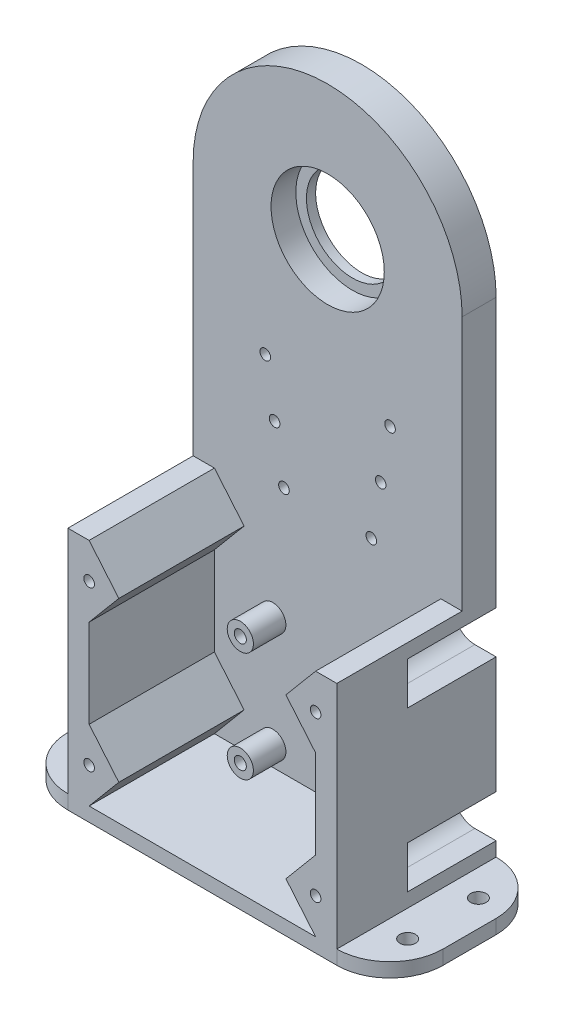
from build123d import *

# Parameters (mm, degrees)
SKIZZE1_W                       = 45
SKIZZE1_H                       = 65
AUFSATZ_LINEAR_AUSTRAGEN1_DEPTH = 38
SKIZZE2_OUTSIDE_W               = 99.932
SKIZZE2_OUTSIDE_H               = 88.932
SCHNITT_LINEAR_AUSTRAGEN1_DEPTH = 35.4
SCHNITT_LINEAR_AUSTRAGEN2_DEPTH = 25
SKIZZE4_R                       = 1.5
SCHNITT_LINEAR_AUSTRAGEN3_DEPTH = 80.334733881
AUFSATZ_LINEAR_AUSTRAGEN2_DEPTH = 9.6
SKIZZE6_R                       = 16
SCHNITT_LINEAR_AUSTRAGEN4_DEPTH = 7
SKIZZE8_R                       = 13
SCHNITT_LINEAR_AUSTRAGEN5_DEPTH = 185.645606501
SKIZZE9_R                       = 1.5
SCHNITT_LINEAR_AUSTRAGEN6_DEPTH = 185.645606501
SKIZZE12_W                      = 76
SKIZZE12_H                      = 45
AUFSATZ_LINEAR_AUSTRAGEN4_DEPTH = 4
SKIZZE10_W                      = 45
SKIZZE10_H                      = 4
AUFSATZ_LINEAR_AUSTRAGEN3_DEPTH = 15
VERRUNDUNG1_R                   = 15
SKIZZE11_R                      = 2.2
SCHNITT_LINEAR_AUSTRAGEN7_DEPTH = 181.433505758
VERRUNDUNG1_OF_SPIEGELN1_R      = 15
SKIZZE13_R                      = 3.7
SKIZZE13_R_2                    = 1.7
AUFSATZ_LINEAR_AUSTRAGEN5_DEPTH = 9.178687268
SCHNITT_LINEAR_START            = -9.6
SKIZZE14_R                      = 1.7
SCHNITT_LINEAR_AUSTRAGEN8_DEPTH = 9.6
SKIZZE15_R                      = 5
SCHNITT_LINEAR_AUSTRAGEN9_DEPTH = 9.6


with BuildPart() as part:
    # Skizze1 → Aufsatz-Linear austragen1 (new, symmetric)
    with BuildSketch(Plane(origin=(0, 0, 0), x_dir=(0, 0, -1), z_dir=(1, 0, 0))):
        with Locations((0, 32.5)):
            Rectangle(SKIZZE1_W, SKIZZE1_H)
    extrude(amount=AUFSATZ_LINEAR_AUSTRAGEN1_DEPTH, both=True)

    # Skizze2 outside → Schnitt-Linear austragen1 (cut)
    with BuildSketch(Plane.XY.offset(22.5)):
        with Locations((0, 32.5)):
            Rectangle(SKIZZE2_OUTSIDE_W, SKIZZE2_OUTSIDE_H)
        Polygon((-38, 0), (-32, 0), (-23.609003688, 10), (-32, 20), (-32, 45), (-23.609003688, 55), (-32, 65), (-38, 65), align=None, mode=Mode.SUBTRACT)
        Polygon((38, 65), (38, 0), (32, 0), (23.609003688, 10), (32, 20), (32, 45), (23.609003688, 55), (32, 65), align=None, mode=Mode.SUBTRACT)
    extrude(amount=-SCHNITT_LINEAR_AUSTRAGEN1_DEPTH, mode=Mode.SUBTRACT)

    # Skizze3 → Schnitt-Linear austragen2 (cut)
    with BuildSketch(Plane(origin=(0, 0, -22.5), x_dir=(-1, 0, 0), z_dir=(0, 0, -1))):
        with BuildLine():
            Line((-32, 16), (-38, 16))
            Line((-38, 16), (-38, 4))
            Line((-38, 4), (-32, 4))
            ThreePointArc((-32, 4), (-26, 10), (-32, 16))
        make_face()
        with BuildLine():
            Line((38, 16), (38, 4))
            Line((38, 4), (32, 4))
            ThreePointArc((32, 4), (26, 10), (32, 16))
            Line((32, 16), (38, 16))
        make_face()
        with BuildLine():
            Line((32, 49), (38, 49))
            Line((38, 49), (38, 61))
            Line((38, 61), (32, 61))
            ThreePointArc((32, 61), (26, 55), (32, 49))
        make_face()
        with BuildLine():
            Line((-38, 49), (-38, 61))
            Line((-38, 61), (-32, 61))
            ThreePointArc((-32, 61), (-26, 55), (-32, 49))
            Line((-32, 49), (-38, 49))
        make_face()
    extrude(amount=-SCHNITT_LINEAR_AUSTRAGEN2_DEPTH, mode=Mode.SUBTRACT)

    # Skizze4 → Schnitt-Linear austragen3 (cut, through all)
    with BuildSketch(Plane(origin=(0, 0, 2.5), x_dir=(-1, 0, 0), z_dir=(0, 0, -1))):
        with Locations(Location((32, 10, 0), (0, 0, 90))):
            Circle(SKIZZE4_R)
        with Locations(Location((-32, 10, 0), (0, 0, 270))):
            Circle(SKIZZE4_R)
        with Locations(Location((-32, 55, 0), (0, 0, 90))):
            Circle(SKIZZE4_R)
        with Locations(Location((32, 55, 0), (0, 0, 270))):
            Circle(SKIZZE4_R)
    extrude(amount=-SCHNITT_LINEAR_AUSTRAGEN3_DEPTH, mode=Mode.SUBTRACT)

    # Skizze5 → Aufsatz-Linear austragen2 (add)
    with BuildSketch(Plane.XY.offset(-12.9)):
        with BuildLine():
            Line((-38, 65), (38, 65))
            Line((38, 65), (38, 137))
            ThreePointArc((38, 137), (0, 175), (-38, 137))
            Line((-38, 137), (-38, 65))
        make_face()
    extrude(amount=-AUFSATZ_LINEAR_AUSTRAGEN2_DEPTH)

    # Skizze6 → Schnitt-Linear austragen4 (cut)
    with BuildSketch(Plane.XY.offset(-12.9)):
        with Locations((0, 137)):
            Circle(SKIZZE6_R)
    extrude(amount=-SCHNITT_LINEAR_AUSTRAGEN4_DEPTH, mode=Mode.SUBTRACT)

    # Skizze8 → Schnitt-Linear austragen5 (cut, through all)
    with BuildSketch(Plane(origin=(0, 0, -22.5), x_dir=(-1, 0, 0), z_dir=(0, 0, -1))):
        with Locations(Location((0, 137, 0), (0, 0, 90))):
            Circle(SKIZZE8_R)
    extrude(amount=-SCHNITT_LINEAR_AUSTRAGEN5_DEPTH, mode=Mode.SUBTRACT)

    # Skizze9 → Schnitt-Linear austragen6 (cut, through all)
    with BuildSketch(Plane(origin=(0, 0, -22.5), x_dir=(-1, 0, 0), z_dir=(0, 0, -1))):
        with Locations(Location((12.34288865, 70, 0), (0, 0, 90))):
            Circle(SKIZZE9_R)
        with Locations(Location((14.98779336, 85, 0), (0, 0, 90))):
            Circle(SKIZZE9_R)
        with Locations(Location((17.632698071, 100, 0), (0, 0, 90))):
            Circle(SKIZZE9_R)
        with Locations(Location((-12.34288865, 70, 0), (0, 0, 180))):
            Circle(SKIZZE9_R)
        with Locations(Location((-17.632698071, 100, 0), (0, 0, 180))):
            Circle(SKIZZE9_R)
        with Locations(Location((-14.98779336, 85, 0), (0, 0, 180))):
            Circle(SKIZZE9_R)
    extrude(amount=-SCHNITT_LINEAR_AUSTRAGEN6_DEPTH, mode=Mode.SUBTRACT)

    # Skizze12 → Aufsatz-Linear austragen4 (add)
    with BuildSketch(Plane.XZ):
        Rectangle(SKIZZE12_W, SKIZZE12_H)
    extrude(amount=AUFSATZ_LINEAR_AUSTRAGEN4_DEPTH)

    # Skizze10 → Aufsatz-Linear austragen3 (add)
    with BuildSketch(Plane(origin=(38, 0, 0), x_dir=(0, 0, -1), z_dir=(1, 0, 0))):
        with Locations((0, -2)):
            Rectangle(SKIZZE10_W, SKIZZE10_H)
    aufsatz_linear_austragen3 = extrude(amount=AUFSATZ_LINEAR_AUSTRAGEN3_DEPTH)

    # Verrundung1
    verrundung1_edges = [part.edges().sort_by_distance(p)[0] for p in [
        (53, -2, 22.5),
        (53, -2, -22.5),
    ]]
    fillet(verrundung1_edges, radius=VERRUNDUNG1_R)

    # Skizze11 → Schnitt-Linear austragen7 (cut, through all)
    with BuildSketch(Plane(origin=(0, 4, 0), x_dir=(1, 0, 0), z_dir=(0, 1, 0))):
        with Locations(Location((45.5, 10, 0), (0, 0, 180))):
            Circle(SKIZZE11_R)
        with Locations(Location((45.5, -10, 0), (0, 0, 90))):
            Circle(SKIZZE11_R)
    schnitt_linear_austragen7 = extrude(amount=-SCHNITT_LINEAR_AUSTRAGEN7_DEPTH, mode=Mode.SUBTRACT)

    # Spiegeln1: Aufsatz-Linear austragen3, Schnitt-Linear austragen7 across plane
    add(aufsatz_linear_austragen3.mirror(Plane(origin=(0, 0, 0), x_dir=(0, 0, 1), z_dir=(1, 0, 0))))
    add(schnitt_linear_austragen7.mirror(Plane(origin=(0, 0, 0), x_dir=(0, 0, 1), z_dir=(1, 0, 0))), mode=Mode.SUBTRACT)

    # Verrundung1 of Spiegeln1
    verrundung1_of_spiegeln1_edges = [part.edges().sort_by_distance(p)[0] for p in [
        (-53, -2, 22.5),
        (-53, -2, -22.5),
    ]]
    fillet(verrundung1_of_spiegeln1_edges, radius=VERRUNDUNG1_OF_SPIEGELN1_R)

    # Skizze13 → Aufsatz-Linear austragen5 (add)
    # profile 1 of 4: a face of its own
    with BuildSketch(Plane.XY.offset(-12.9)):
        with Locations(Location((-15.5, 36.65, 0), (0, 0, 180))):
            Circle(SKIZZE13_R)
        with Locations(Location((-15.5, 36.65, 0), (0, 0, 180))):
            Circle(SKIZZE13_R_2, mode=Mode.SUBTRACT)
    # profile 2 of 4: a face of its own
    with BuildSketch(Plane.XY.offset(-12.9)):
        with Locations(Location((15.5, 36.65, 0), (0, 0, 180))):
            Circle(SKIZZE13_R)
        with Locations(Location((15.5, 36.65, 0), (0, 0, 180))):
            Circle(SKIZZE13_R_2, mode=Mode.SUBTRACT)
    # profile 3 of 4: a face of its own
    with BuildSketch(Plane.XY.offset(-12.9)):
        with Locations(Location((15.5, 5.65, 0), (0, 0, 180))):
            Circle(SKIZZE13_R)
        with Locations(Location((15.5, 5.65, 0), (0, 0, 180))):
            Circle(SKIZZE13_R_2, mode=Mode.SUBTRACT)
    # profile 4 of 4: a face of its own
    with BuildSketch(Plane.XY.offset(-12.9)):
        with Locations(Location((-15.5, 5.65, 0), (0, 0, 180))):
            Circle(SKIZZE13_R)
        with Locations(Location((-15.5, 5.65, 0), (0, 0, 180))):
            Circle(SKIZZE13_R_2, mode=Mode.SUBTRACT)
    extrude(amount=AUFSATZ_LINEAR_AUSTRAGEN5_DEPTH)

    # Skizze14 → Schnitt-Linear austragen8 (cut)
    with BuildSketch(Plane.XY.offset(-12.9).offset(SCHNITT_LINEAR_START)):
        with Locations(Location((-15.5, 5.65, 0), (0, 0, 180))):
            Circle(SKIZZE14_R)
        with Locations(Location((15.5, 5.65, 0), (0, 0, 180))):
            Circle(SKIZZE14_R)
        with Locations(Location((15.5, 36.65, 0), (0, 0, 180))):
            Circle(SKIZZE14_R)
        with Locations(Location((-15.5, 36.65, 0), (0, 0, 180))):
            Circle(SKIZZE14_R)
    extrude(amount=SCHNITT_LINEAR_AUSTRAGEN8_DEPTH, mode=Mode.SUBTRACT)

    # Skizze15 → Schnitt-Linear austragen9 (cut)
    with BuildSketch(Plane(origin=(0, 0, -22.5), x_dir=(-1, 0, 0), z_dir=(0, 0, -1))):
        with Locations(Location((0, 21.15, 0), (0, 0, 90))):
            Circle(SKIZZE15_R)
    extrude(amount=-SCHNITT_LINEAR_AUSTRAGEN9_DEPTH, mode=Mode.SUBTRACT)


solid = part.part
